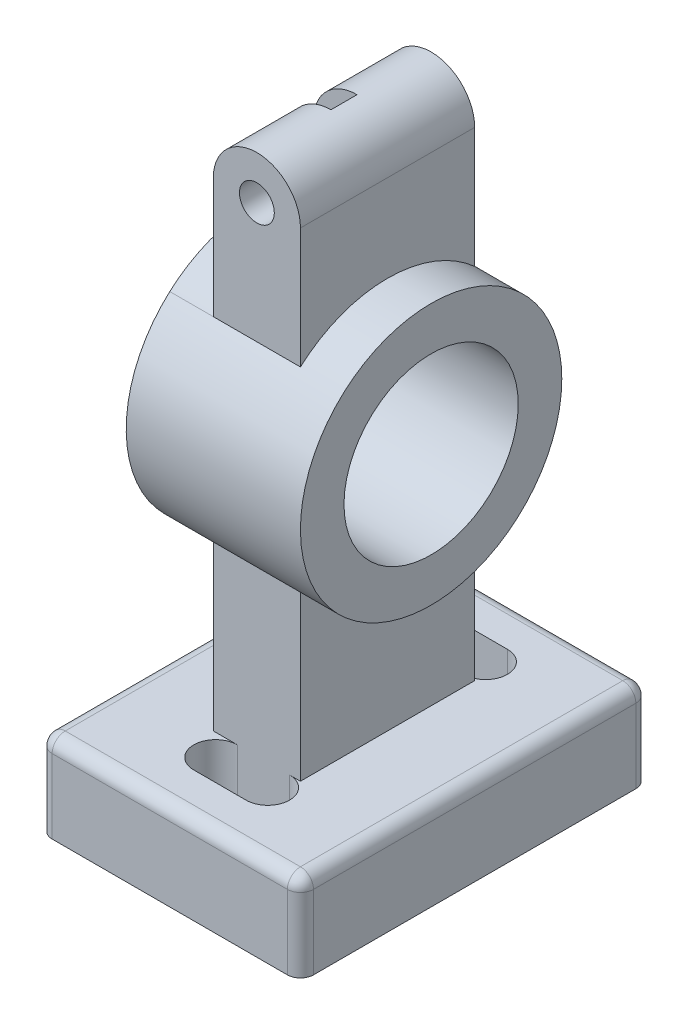
from build123d import *

# Parameters (mm, degrees)
BOSS_EXTRUDE1_DEPTH = 1
FILLET1_R           = 0.15
SKETCH2_R           = 0.2
BOSS_EXTRUDE2_DEPTH = 1
SKETCH3_R           = 1.5
SKETCH3_R_2         = 1
BOSS_EXTRUDE3_DEPTH = 1
SKETCH4_R           = 1
CUT_EXTRUDE1_DEPTH  = 8.549834435
CUT_EXTRUDE3_START  = -2
CUT_EXTRUDE3_DEPTH  = 2


with BuildPart() as part:
    # Sketch1 → Boss-Extrude1 (new body)
    with BuildSketch(Plane(origin=(0, 0, 0), x_dir=(1, 0, 0), z_dir=(0, 1, 0))):
        with BuildLine():
            Line((-1.35, 2), (1.35, 2))
            ThreePointArc((1.35, 2), (1.456066017, 1.956066017), (1.5, 1.85))
            Line((1.5, 1.85), (1.5, -1.85))
            ThreePointArc((1.5, -1.85), (1.456066017, -1.956066017), (1.35, -2))
            Line((1.35, -2), (-1.35, -2))
            ThreePointArc((-1.35, -2), (-1.456066017, -1.956066017), (-1.5, -1.85))
            Line((-1.5, -1.85), (-1.5, 1.85))
            ThreePointArc((-1.5, 1.85), (-1.456066017, 1.956066017), (-1.35, 2))
        make_face()
        with BuildLine():
            Line((-0.224469736, 1.5), (0.375530264, 1.5))
            ThreePointArc((0.375530264, 1.5), (0.625530264, 1.25), (0.375530264, 1))
            Line((0.375530264, 1), (-0.224469736, 1))
            ThreePointArc((-0.224469736, 1), (-0.474469736, 1.25), (-0.224469736, 1.5))
        make_face(mode=Mode.SUBTRACT)
        with BuildLine():
            Line((-0.224469736, -1.5), (0.375530264, -1.5))
            ThreePointArc((0.375530264, -1.5), (0.625530264, -1.25), (0.375530264, -1))
            Line((0.375530264, -1), (-0.224469736, -1))
            ThreePointArc((-0.224469736, -1), (-0.474469736, -1.25), (-0.224469736, -1.5))
        make_face(mode=Mode.SUBTRACT)
    extrude(amount=BOSS_EXTRUDE1_DEPTH)

    # Fillet1
    fillet1_edges = [part.edges().sort_by_distance(p)[0] for p in [
        (1.456066017, 1, -1.956066017),
        (0, 1, -2),
        (-1.456066017, 1, -1.956066017),
        (-1.5, 1, 0),
        (-1.456066017, 1, 1.956066017),
        (0, 1, 2),
        (1.456066017, 1, 1.956066017),
        (1.5, 1, 0),
    ]]
    fillet(fillet1_edges, radius=FILLET1_R)

    # Sketch2 → Boss-Extrude2 (add, symmetric)
    with BuildSketch(Plane.XY):
        with BuildLine():
            Line((-0.5, 1), (0.5, 1))
            Line((0.5, 1), (0.5, 6.5))
            ThreePointArc((0.5, 6.5), (0, 7), (-0.5, 6.5))
            Line((-0.5, 6.5), (-0.5, 1))
        make_face()
        with Locations((0, 6.5)):
            Circle(SKETCH2_R, mode=Mode.SUBTRACT)
    extrude(amount=BOSS_EXTRUDE2_DEPTH, both=True)

    # Sketch3 → Boss-Extrude3 (add, symmetric)
    with BuildSketch(Plane(origin=(0, 0, 0), x_dir=(0, 0, -1), z_dir=(1, 0, 0))):
        with Locations((0, 4)):
            Circle(SKETCH3_R)
        with Locations((0, 4)):
            Circle(SKETCH3_R_2, mode=Mode.SUBTRACT)
    extrude(amount=BOSS_EXTRUDE3_DEPTH, both=True)

    # Sketch4 → Cut-Extrude1 (cut, through all)
    with BuildSketch(Plane.ZY.offset(0.5)):
        with Locations(Location((0, 4, 0), (0, 0, 180))):
            Circle(SKETCH4_R)
    extrude(amount=-CUT_EXTRUDE1_DEPTH, mode=Mode.SUBTRACT)

    # Sketch5 → Cut-Extrude3 (cut)
    with BuildSketch(Plane(origin=(0, 0, 0), x_dir=(0, 0, -1), z_dir=(1, 0, 0)).offset(CUT_EXTRUDE3_START)):
        with BuildLine():
            Line((0.15, 4.988685997), (0.15, 7))
            Line((0.15, 7), (-0.15, 7))
            Line((-0.15, 7), (-0.15, 4.988685997))
            ThreePointArc((-0.15, 4.988685997), (0, 5), (0.15, 4.988685997))
        make_face()
    extrude(amount=CUT_EXTRUDE3_DEPTH, mode=Mode.SUBTRACT)


solid = part.part
